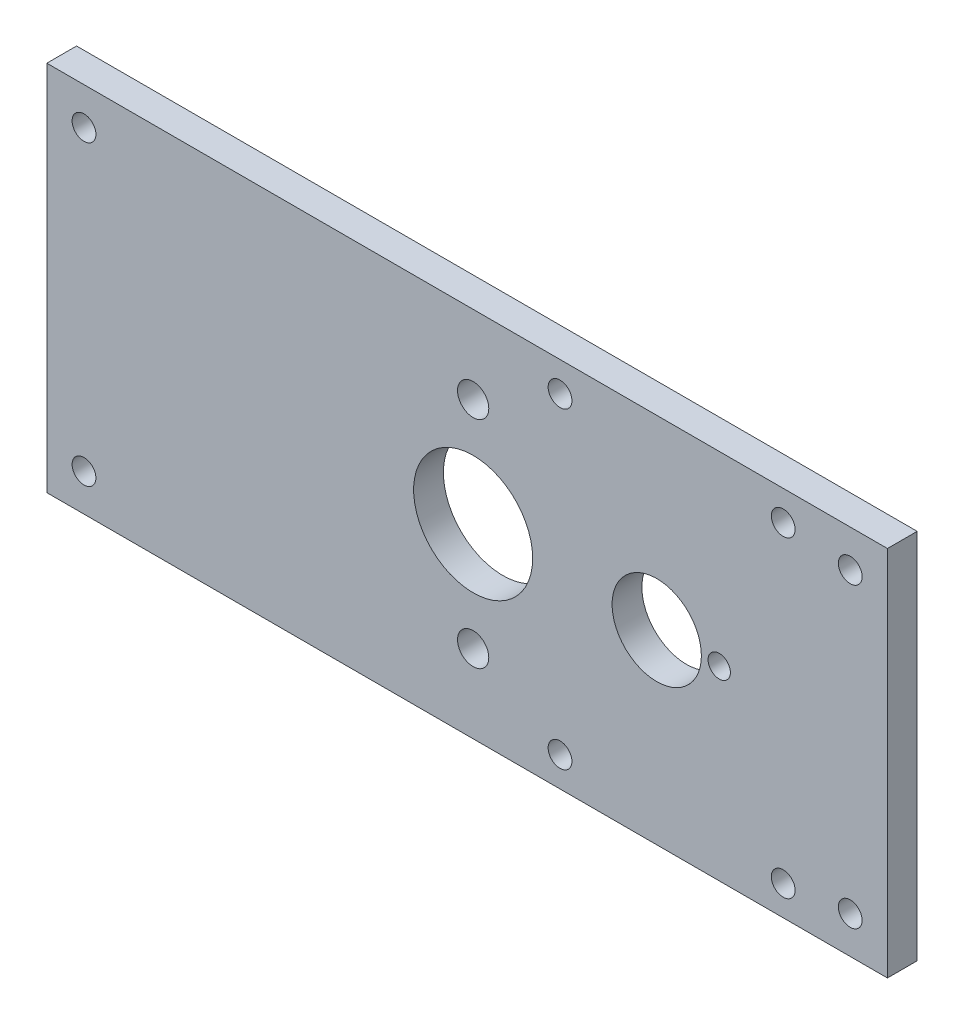
from build123d import *

# Parameters (mm, degrees)
SKETCH_1_W          = 113
SKETCH_1_H          = 50
SKETCH_1_R          = 1.6
SKETCH_1_R_2        = 8
SKETCH_1_R_3        = 6
EXTRUDE_1_DEPTH     = 4
SKETCH_2_R          = 1.5
SKETCH_2_R_2        = 1.6
SKETCH_2_R_3        = 2.1
CUT_EXTRUDE_1_DEPTH = 124.632519994


with BuildPart() as part:
    # ｽｹｯﾁ1 → ﾎﾞｽ - 押し出し1 (new body)
    with BuildSketch(Plane.XY):
        with Locations((56.5, 25)):
            Rectangle(SKETCH_1_W, SKETCH_1_H)
        with Locations((5, 45)):
            Circle(SKETCH_1_R, mode=Mode.SUBTRACT)
        with Locations((5, 5)):
            Circle(SKETCH_1_R, mode=Mode.SUBTRACT)
        with Locations((108, 45)):
            Circle(SKETCH_1_R, mode=Mode.SUBTRACT)
        with Locations((108, 5)):
            Circle(SKETCH_1_R, mode=Mode.SUBTRACT)
        with Locations((57.31, 25)):
            Circle(SKETCH_1_R_2, mode=Mode.SUBTRACT)
        with Locations((81.99, 25)):
            Circle(SKETCH_1_R_3, mode=Mode.SUBTRACT)
    extrude(amount=EXTRUDE_1_DEPTH)

    # ｽｹｯﾁ2 → ｶｯﾄ - 押し出し1 (cut, through all)
    with BuildSketch(Plane.XY.offset(4)):
        with Locations((90.39, 25)):
            Circle(SKETCH_2_R)
        with Locations((98.99, 46)):
            Circle(SKETCH_2_R_2)
        with Locations((98.99, 4)):
            Circle(SKETCH_2_R_2)
        with Locations((68.99, 4)):
            Circle(SKETCH_2_R_2)
        with Locations((68.99, 46)):
            Circle(SKETCH_2_R_2)
        with Locations((57.31, 39.5)):
            Circle(SKETCH_2_R_3)
        with Locations((57.31, 10.5)):
            Circle(SKETCH_2_R_3)
    extrude(amount=-CUT_EXTRUDE_1_DEPTH, mode=Mode.SUBTRACT)


solid = part.part
